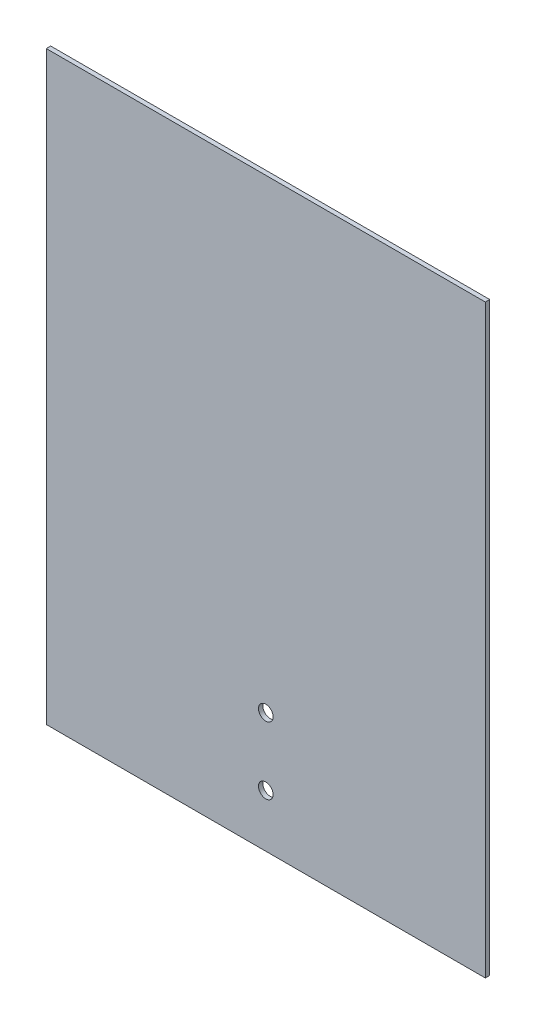
from build123d import *

# Parameters (mm, degrees)
SKETCH_1_W          = 150
SKETCH_1_H          = 200
EXTRUDE_1_DEPTH     = 1.5
SKETCH_2_R          = 2.5
CUT_EXTRUDE_1_DEPTH = 1.5


with BuildPart() as part:
    # 草图1 → 凸台-拉伸1 (new body)
    with BuildSketch(Plane.XY):
        Rectangle(SKETCH_1_W, SKETCH_1_H)
    extrude(amount=EXTRUDE_1_DEPTH)

    # 草图2 → 切除-拉伸1 (cut)
    with BuildSketch(Plane.XY.offset(1.5)):
        with Locations((0, -59)):
            Circle(SKETCH_2_R)
        with Locations((0, -82)):
            Circle(SKETCH_2_R)
    extrude(amount=-CUT_EXTRUDE_1_DEPTH, mode=Mode.SUBTRACT)


solid = part.part
